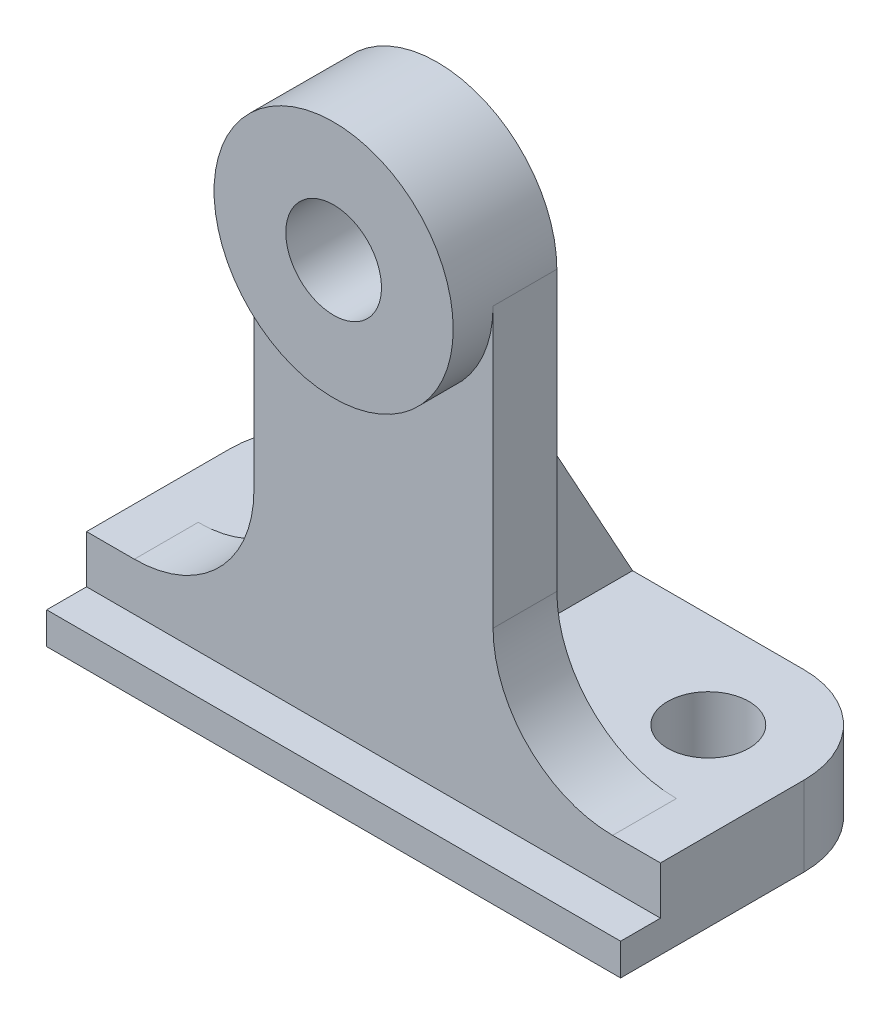
from build123d import *

# Parameters (mm, degrees)
BOSS_EXTRUDE1_DEPTH = 8
SKETCH1_3_R         = 6
BOSS_EXTRUDE2_DEPTH = 13
SKETCH2_W           = 72
SKETCH2_H           = 10
BOSS_EXTRUDE3_DEPTH = 22
SKETCH3_R           = 5.1
CUT_EXTRUDE1_DEPTH  = 22
SKETCH4_W           = 72
SKETCH4_H           = 4
BOSS_EXTRUDE4_DEPTH = 5
BOSS_EXTRUDE5_DEPTH = 2.5


with BuildPart() as part:
    # Sketch1 → Boss-Extrude1 (new body)
    with BuildSketch(Plane.XY):
        with BuildLine():
            Line((-36, 10), (-36, 0))
            Line((-36, 0), (36, 0))
            Line((36, 0), (36, 10))
            Line((36, 10), (30, 10))
            ThreePointArc((30, 10), (19.393398282, 14.393398282), (15, 25))
            Line((15, 25), (15, 60))
            ThreePointArc((15, 60), (0, 45), (-15, 60))
            Line((-15, 60), (-15, 25))
            ThreePointArc((-15, 25), (-19.393398282, 14.393398282), (-30, 10))
            Line((-30, 10), (-36, 10))
        make_face()
    extrude(amount=BOSS_EXTRUDE1_DEPTH)

    # Sketch1<3> → Boss-Extrude2 (add)
    with BuildSketch(Plane.XY):
        with BuildLine():
            ThreePointArc((15, 60), (0, 75), (-15, 60))
            ThreePointArc((-15, 60), (0, 45), (15, 60))
        make_face()
        with Locations((0, 60)):
            Circle(SKETCH1_3_R, mode=Mode.SUBTRACT)
    extrude(amount=BOSS_EXTRUDE2_DEPTH)

    # Sketch2 → Boss-Extrude3 (add)
    with BuildSketch(Plane(origin=(0, 0, 0), x_dir=(-1, 0, 0), z_dir=(0, 0, -1))):
        with Locations((0, 5)):
            Rectangle(SKETCH2_W, SKETCH2_H)
    extrude(amount=BOSS_EXTRUDE3_DEPTH)

    # Sketch3 → Cut-Extrude1 (cut)
    with BuildSketch(Plane(origin=(0, 10, 0), x_dir=(1, 0, 0), z_dir=(0, 1, 0))):
        with BuildLine():
            ThreePointArc((-36, 10), (-32.485281374, 18.485281374), (-24, 22))
            Line((-24, 22), (-36, 22))
            Line((-36, 22), (-36, 10))
        make_face()
        with BuildLine():
            Line((36, 22), (24, 22))
            ThreePointArc((24, 22), (32.485281374, 18.485281374), (36, 10))
            Line((36, 10), (36, 22))
        make_face()
        with Locations((-24, 10)):
            Circle(SKETCH3_R)
        with Locations((24, 10)):
            Circle(SKETCH3_R)
    extrude(amount=-CUT_EXTRUDE1_DEPTH, mode=Mode.SUBTRACT)

    # Sketch4 → Boss-Extrude4 (add)
    with BuildSketch(Plane.XY.offset(8)):
        with Locations((0, 2)):
            Rectangle(SKETCH4_W, SKETCH4_H)
    extrude(amount=BOSS_EXTRUDE4_DEPTH)

    # Sketch5 → Boss-Extrude5 (add, symmetric)
    with BuildSketch(Plane(origin=(0, 0, 0), x_dir=(0, 0, -1), z_dir=(1, 0, 0))):
        Polygon((0, 10), (0, 50), (22, 10), align=None)
    extrude(amount=BOSS_EXTRUDE5_DEPTH, both=True)


solid = part.part
